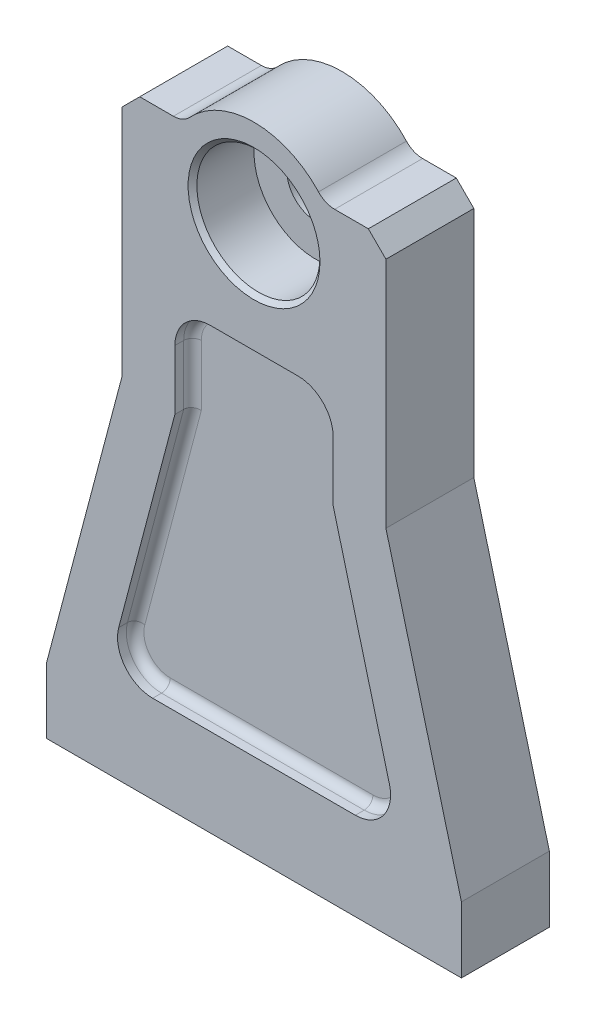
from build123d import *

# Parameters (mm, degrees)
SKETCH1_R                         = 6.5
BOSS_EXTRUDE1_DEPTH               = 10
SKETCH2_R                         = 14
CUT_EXTRUDE1_DEPTH                = 14
CHAMFER1_SIZE                     = 4
CHAMFER2_SIZE                     = 1
FILLET2_R                         = 5
CUT_EXTRUDE2_DEPTH                = 4
FILLET3_R                         = 2
FILLET3_OF_MIRROR1_R              = 2
M10X1_25_TAPPED_HOLE1_D           = 8.8
M10X1_25_TAPPED_HOLE1_DEPTH       = 20
M10X1_25_TAPPED_HOLE1_CSINK_D     = 10.05
M10X1_25_TAPPED_HOLE1_CSINK_ANGLE = 90
M10X1_25_TAPPED_HOLE1_TIP         = 2.643786724


with BuildPart() as part:
    # Sketch1 → Boss-Extrude1 (new, symmetric)
    with BuildSketch(Plane.XY):
        with BuildLine():
            Line((-47.170361299, 15), (-47.170361299, 0))
            Line((-47.170361299, 0), (47.170361299, 0))
            Line((47.170361299, 0), (47.170361299, 15))
            Line((47.170361299, 15), (30, 80))
            Line((30, 80), (30, 137))
            Line((30, 137), (16, 137))
            ThreePointArc((16, 137), (0, 145), (-16, 137))
            Line((-16, 137), (-30, 137))
            Line((-30, 137), (-30, 80))
            Line((-30, 80), (-47.170361299, 15))
        make_face()
        with Locations((0, 125)):
            Circle(SKETCH1_R, mode=Mode.SUBTRACT)
    extrude(amount=BOSS_EXTRUDE1_DEPTH, both=True)

    # Sketch2 → Cut-Extrude1 (cut)
    with BuildSketch(Plane.XY.offset(10)):
        with Locations((0, 125)):
            Circle(SKETCH2_R)
    extrude(amount=-CUT_EXTRUDE1_DEPTH, mode=Mode.SUBTRACT)

    # Chamfer1
    chamfer1_edges = [part.edges().sort_by_distance(p)[0] for p in [
        (30, 137, 0),
        (-30, 137, 0),
    ]]
    chamfer(chamfer1_edges, length=CHAMFER1_SIZE)

    # Chamfer2
    chamfer2_edges = [part.edges().sort_by_distance(p)[0] for p in [
        (-14, 125, 10),
    ]]
    chamfer(chamfer2_edges, length=CHAMFER2_SIZE)

    # Fillet2
    fillet2_edges = [part.edges().sort_by_distance(p)[0] for p in [
        (-16, 137, 0),
        (16, 137, 0),
    ]]
    fillet(fillet2_edges, radius=FILLET2_R)

    # Sketch3 → Cut-Extrude2 (cut)
    with BuildSketch(Plane.XY.offset(10)):
        with BuildLine():
            Line((-10, 100), (10, 100))
            ThreePointArc((10, 100), (15.656854249, 97.656854249), (18, 92))
            Line((18, 92), (18, 78.441768634))
            Line((18, 78.441768634), (30.784939674, 30.043190159))
            ThreePointArc((30.784939674, 30.043190159), (29.388451789, 23.118684669), (23.050253256, 20))
            Line((23.050253256, 20), (-23.050253256, 20))
            ThreePointArc((-23.050253256, 20), (-29.388451789, 23.118684669), (-30.784939674, 30.043190159))
            Line((-30.784939674, 30.043190159), (-18, 78.441768634))
            Line((-18, 78.441768634), (-18, 92))
            ThreePointArc((-18, 92), (-15.656854249, 97.656854249), (-10, 100))
        make_face()
    cut_extrude2 = extrude(amount=-CUT_EXTRUDE2_DEPTH, mode=Mode.SUBTRACT)

    # Fillet3
    fillet3_edges = [part.edges().sort_by_distance(p)[0] for p in [
        (-29.388451789, 23.118684669, 6),
        (-24.392469837, 54.242479397, 6),
        (-18, 85.220884317, 6),
        (-15.656854249, 97.656854249, 6),
        (0, 100, 6),
        (15.656854249, 97.656854249, 6),
        (18, 85.220884317, 6),
        (24.392469837, 54.242479397, 6),
        (29.388451789, 23.118684669, 6),
        (0, 20, 6),
    ]]
    fillet(fillet3_edges, radius=FILLET3_R)

    # Mirror1: Cut-Extrude2 across plane
    add(cut_extrude2.mirror(Plane.XY), mode=Mode.SUBTRACT)

    # Fillet3 of Mirror1
    fillet3_of_mirror1_edges = [part.edges().sort_by_distance(p)[0] for p in [
        (-29.388451789, 23.118684669, -6),
        (-24.392469837, 54.242479397, -6),
        (-18, 85.220884317, -6),
        (-15.656854249, 97.656854249, -6),
        (0, 100, -6),
        (15.656854249, 97.656854249, -6),
        (18, 85.220884317, -6),
        (24.392469837, 54.242479397, -6),
        (29.388451789, 23.118684669, -6),
        (0, 20, -6),
    ]]
    fillet(fillet3_of_mirror1_edges, radius=FILLET3_OF_MIRROR1_R)

    # M10x1.25 Tapped Hole1
    with Locations(Plane(origin=(0, 0, 0), x_dir=(-1, 0, 0), z_dir=(0, -1, 0))):
        with Locations((-31.170361299, 0), (28.829638701, 0)):
            CounterSinkHole(M10X1_25_TAPPED_HOLE1_D / 2, M10X1_25_TAPPED_HOLE1_CSINK_D / 2, depth=M10X1_25_TAPPED_HOLE1_DEPTH, counter_sink_angle=M10X1_25_TAPPED_HOLE1_CSINK_ANGLE)
            with Locations((0, 0, -(M10X1_25_TAPPED_HOLE1_DEPTH + M10X1_25_TAPPED_HOLE1_TIP / 2))):  # 118° drill point
                Cone(0, M10X1_25_TAPPED_HOLE1_D / 2, M10X1_25_TAPPED_HOLE1_TIP, mode=Mode.SUBTRACT)


solid = part.part
